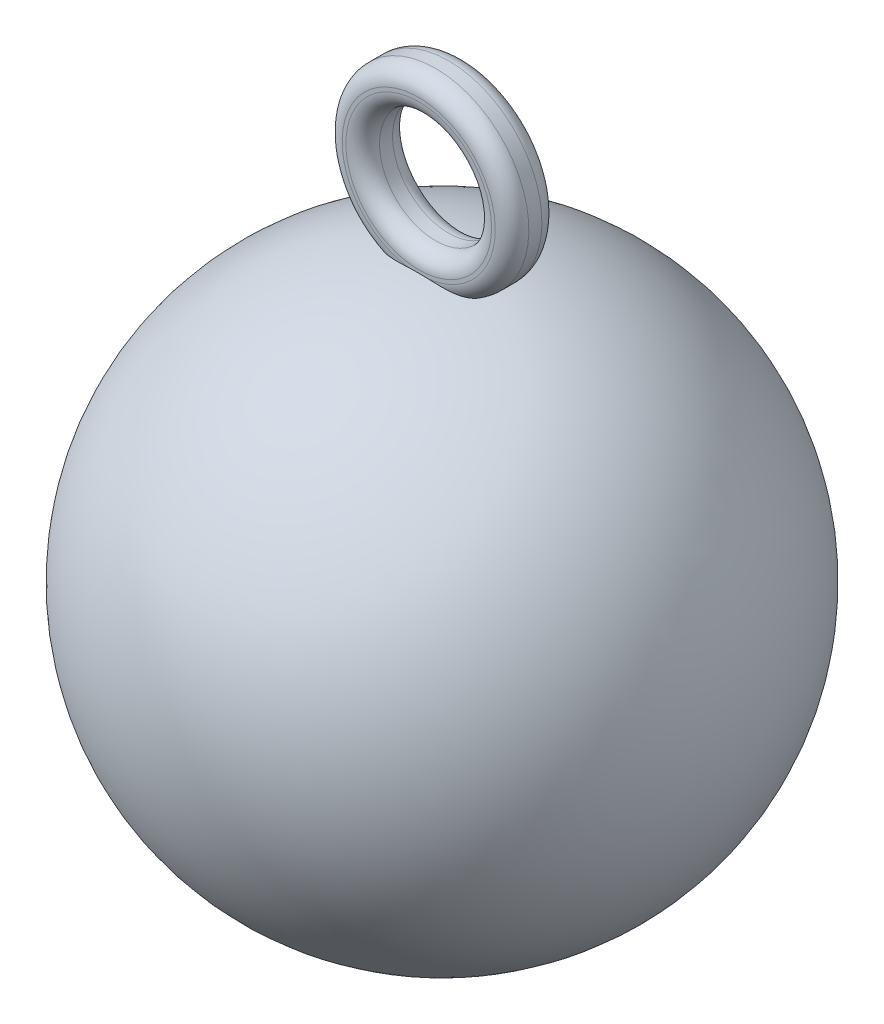
from build123d import *

# Parameters (mm, degrees)
SCHIZZO2_R                   = 5
SCHIZZO2_R_2                 = 3
ESTRUSIONE_ESTRUSIONE1_DEPTH = 1.25
RACCORDO4_R                  = 0.9


with BuildPart() as part:
    # Schizzo1 → Rivoluzione8 (revolve)
    with BuildSketch(Plane.XY):
        with BuildLine():
            Line((0, -15), (0, 15))
            ThreePointArc((0, 15), (-15, 0), (0, -15))
        make_face()
    revolve(axis=Axis((0, 32.442859412, 0), (0, -1, 0)))

    # Schizzo2 → Estrusione-Estrusione1 (add, symmetric)
    with BuildSketch(Plane.XY):
        with Locations((0, 19.00431954)):
            Circle(SCHIZZO2_R)
        with Locations((0, 19.00431954)):
            Circle(SCHIZZO2_R_2, mode=Mode.SUBTRACT)
    extrude(amount=ESTRUSIONE_ESTRUSIONE1_DEPTH, both=True)

    # Raccordo4
    raccordo4_edges = [part.edges().sort_by_distance(p)[0] for p in [
        (-3, 19.00431954, 1.25),
        (-3, 19.00431954, -1.25),
        (0, 24.00431954, -1.25),
        (0, 24.00431954, 1.25),
    ]]
    fillet(raccordo4_edges, radius=RACCORDO4_R)


solid = part.part
